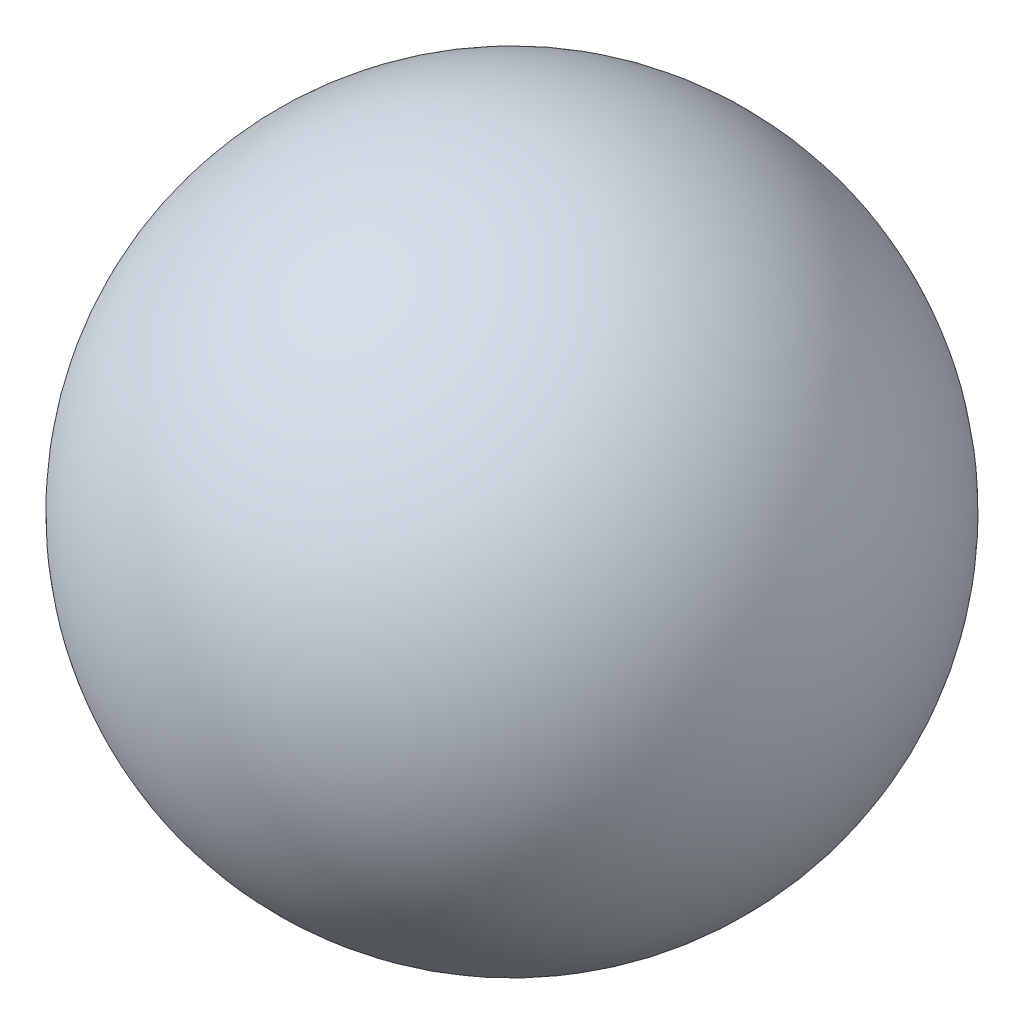
from build123d import *


with BuildPart() as part:
    # Sketch1 → Revolve1 (revolve)
    with BuildSketch(Plane(origin=(0, 0, 0), x_dir=(1, 0, 0), z_dir=(0, 1, 0))):
        with BuildLine():
            Line((0, 8), (0, -8))
            ThreePointArc((0, -8), (8, 0), (0, 8))
        make_face()
    revolve(axis=Axis((0, 0, -8), (0, 0, 1)))


solid = part.part
